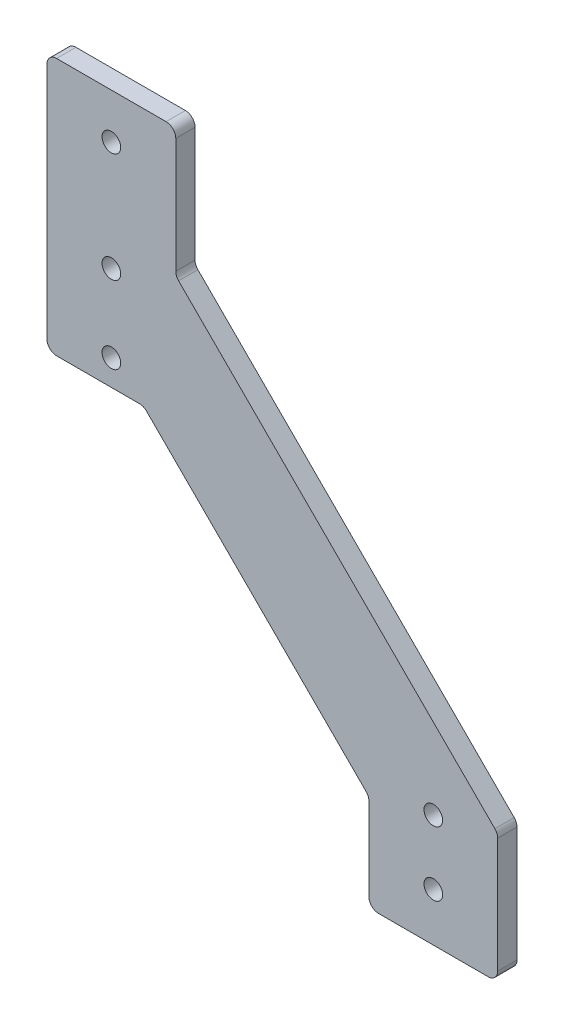
from build123d import *

# Parameters (mm, degrees)
SKETCH1_R           = 1.45
BOSS_EXTRUDE1_DEPTH = 3
FILLET1_R           = 1.5


with BuildPart() as part:
    # Sketch1 → Boss-Extrude1 (new body)
    with BuildSketch(Plane.XY):
        Polygon((-20, -20), (-5, -20), (30, -55), (30, -70), (50, -70), (50, -50), (0, 0), (0, 20), (-20, 20), (-20, 0), align=None)
        with Locations((-10, -16)):
            Circle(SKETCH1_R, mode=Mode.SUBTRACT)
        with Locations((-10, -4)):
            Circle(SKETCH1_R, mode=Mode.SUBTRACT)
        with Locations((40, -52.5)):
            Circle(SKETCH1_R, mode=Mode.SUBTRACT)
        with Locations((40, -62.5)):
            Circle(SKETCH1_R, mode=Mode.SUBTRACT)
        with Locations((-10, 13)):
            Circle(SKETCH1_R, mode=Mode.SUBTRACT)
    extrude(amount=BOSS_EXTRUDE1_DEPTH)

    # Fillet1
    fillet1_edges = [part.edges().sort_by_distance(p)[0] for p in [
        (-20, 20, 1.5),
        (0, 20, 1.5),
        (0, 0, 1.5),
        (50, -50, 1.5),
        (50, -70, 1.5),
        (30, -70, 1.5),
        (30, -55, 1.5),
        (-5, -20, 1.5),
        (-20, -20, 1.5),
    ]]
    fillet(fillet1_edges, radius=FILLET1_R)


solid = part.part
